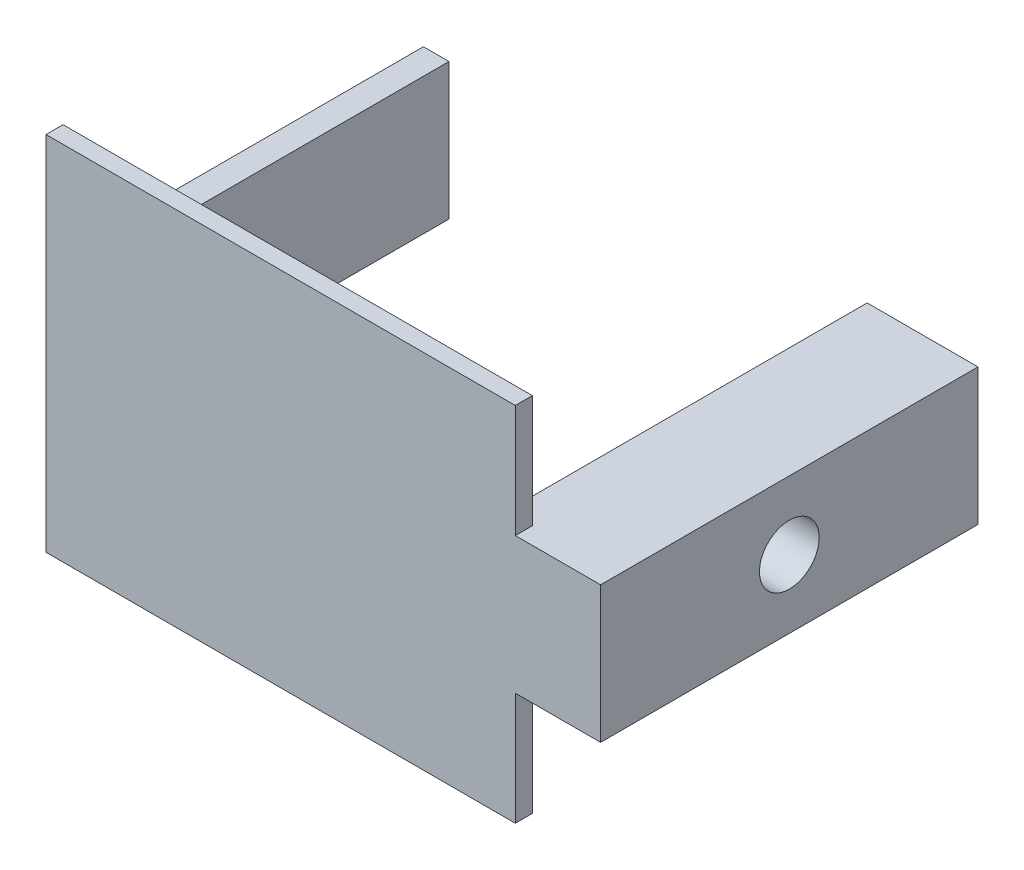
from build123d import *

# Parameters (mm, degrees)
SKETCH1_W             = 3
SKETCH1_H             = 16
BOSS_EXTRUDE1_DEPTH   = 42.25
BOSS_EXTRUDE1_2_DEPTH = 42.25
SKETCH2_W             = 55.024264068
SKETCH2_H             = 42.424264068
BOSS_EXTRUDE2_DEPTH   = 2
SKETCH4_W             = 44.25
SKETCH4_H             = 16
SKETCH4_R             = 3.5
BOSS_EXTRUDE4_DEPTH   = 10


with BuildPart() as part:
    # Sketch1 → Boss-Extrude1 (new body)
    with BuildSketch(Plane.XY):
        with Locations((26.012132034, 0)):
            Rectangle(SKETCH1_W, SKETCH1_H)
    extrude(amount=BOSS_EXTRUDE1_DEPTH)



with BuildPart() as body_2:
    # Sketch1 → Boss-Extrude1 2 (new body)
    with BuildSketch(Plane.XY):
        with Locations((-26.012132034, 0)):
            Rectangle(SKETCH1_W, SKETCH1_H)
    extrude(amount=BOSS_EXTRUDE1_2_DEPTH)


with BuildPart() as part_1:
    add(part.part)

    add(body_2.part)  # Boss-Extrude2 merges body 2
    # Sketch2 → Boss-Extrude2 (add)
    with BuildSketch(Plane.XY.offset(42.25)):
        Rectangle(SKETCH2_W, SKETCH2_H)
    extrude(amount=BOSS_EXTRUDE2_DEPTH)

    # Sketch4 → Boss-Extrude4 (add)
    with BuildSketch(Plane(origin=(27.512132034, 0, 0), x_dir=(0, 0, -1), z_dir=(1, 0, 0))):
        with Locations((-22.125, 0)):
            Rectangle(SKETCH4_W, SKETCH4_H)
        with Locations((-22.125, 0)):
            Circle(SKETCH4_R, mode=Mode.SUBTRACT)
    extrude(amount=BOSS_EXTRUDE4_DEPTH)


solid = part_1.part
